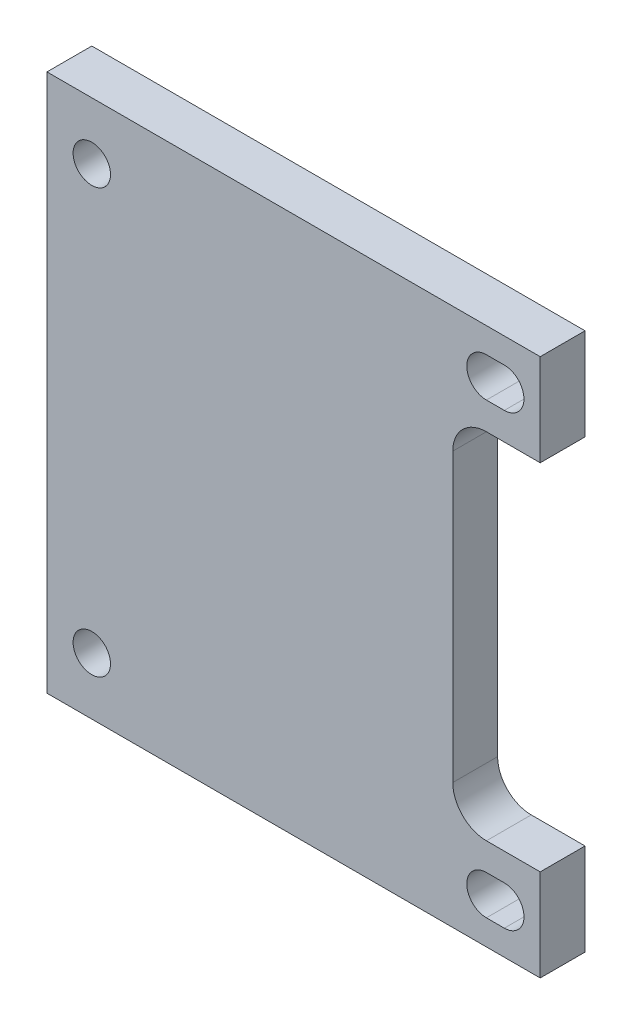
from build123d import *

# Parameters (mm, degrees)
SKETCH1_W                = 69.85
SKETCH1_H                = 76.2
BOSS_EXTRUDE1_DEPTH      = 6.35
M5_CLEARANCE_HOLE1_D     = 5.3
M5_CLEARANCE_HOLE1_DEPTH = 6.35
M5_CLEARANCE_HOLE1_TIP   = 1.59228064
CUT_EXTRUDE1_DEPTH       = 104.565365832
CUT_EXTRUDE2_DEPTH       = 104.565365832


with BuildPart() as part:
    # Sketch1 → Boss-Extrude1 (new body)
    with BuildSketch(Plane.XY):
        with Locations((34.925, 38.1)):
            Rectangle(SKETCH1_W, SKETCH1_H)
    extrude(amount=BOSS_EXTRUDE1_DEPTH)

    # M5 Clearance Hole1
    with Locations(Plane(origin=(6.35, 68.1, 6.35), x_dir=(1, 0, 0), z_dir=(0, 0, 1))):
        with Locations((0, 0), (0, -60)):
            Hole(M5_CLEARANCE_HOLE1_D / 2, depth=M5_CLEARANCE_HOLE1_DEPTH)
            with Locations((0, 0, -(M5_CLEARANCE_HOLE1_DEPTH + M5_CLEARANCE_HOLE1_TIP / 2))):  # 118° drill point
                Cone(0, M5_CLEARANCE_HOLE1_D / 2, M5_CLEARANCE_HOLE1_TIP, mode=Mode.SUBTRACT)

    # Sketch4 → Cut-Extrude1 (cut, through all)
    with BuildSketch(Plane.XY.offset(6.35)):
        with BuildLine():
            Line((64.77, 67.071875), (62.23, 67.071875))
            ThreePointArc((62.23, 67.071875), (59.451875, 69.85), (62.23, 72.628125))
            Line((62.23, 72.628125), (64.77, 72.628125))
            ThreePointArc((64.77, 72.628125), (67.548125, 69.85), (64.77, 67.071875))
        make_face()
        with BuildLine():
            Line((64.77, 9.128125), (62.23, 9.128125))
            ThreePointArc((62.23, 9.128125), (59.451875, 6.35), (62.23, 3.571875))
            Line((62.23, 3.571875), (64.77, 3.571875))
            ThreePointArc((64.77, 3.571875), (67.548125, 6.35), (64.77, 9.128125))
        make_face()
    extrude(amount=-CUT_EXTRUDE1_DEPTH, mode=Mode.SUBTRACT)

    # Sketch5 → Cut-Extrude2 (cut, through all)
    with BuildSketch(Plane.XY.offset(6.35)):
        with BuildLine():
            Line((66.9925, 17.78), (66.9925, 58.42))
            ThreePointArc((66.9925, 58.42), (62.23, 63.1825), (57.4675, 58.42))
            Line((57.4675, 58.42), (57.4675, 17.78))
            ThreePointArc((57.4675, 17.78), (62.23, 13.0175), (66.9925, 17.78))
        make_face()
        with BuildLine():
            ThreePointArc((66.9925, 17.78), (65.597596045, 14.412403955), (62.23, 13.0175))
            Line((62.23, 13.0175), (69.85, 13.0175))
            Line((69.85, 13.0175), (69.85, 63.1825))
            Line((69.85, 63.1825), (62.23, 63.1825))
            ThreePointArc((62.23, 63.1825), (65.597596045, 61.787596045), (66.9925, 58.42))
            Line((66.9925, 58.42), (66.9925, 17.78))
        make_face()
    extrude(amount=-CUT_EXTRUDE2_DEPTH, mode=Mode.SUBTRACT)


solid = part.part
